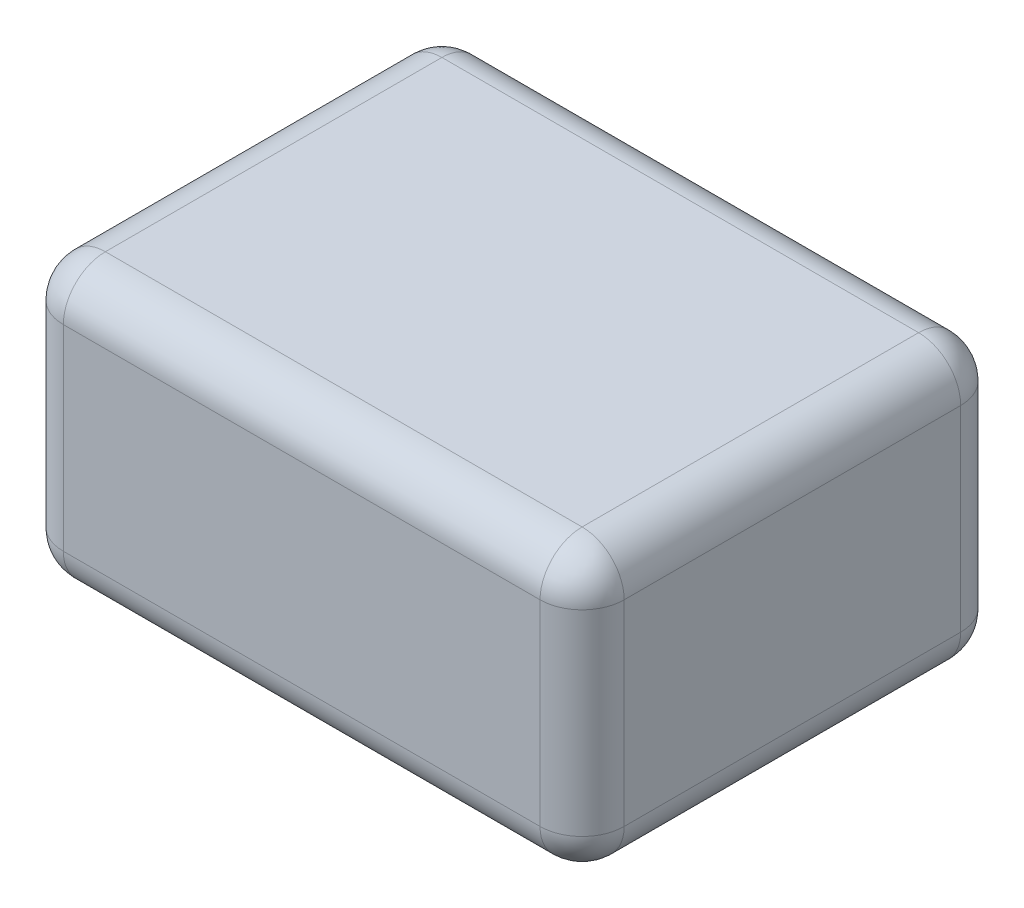
from build123d import *

# Parameters (mm, degrees)
SKETCH1_W           = 40
SKETCH1_H           = 30
BOSS_EXTRUDE1_DEPTH = 20
FILLET1_R           = 3


with BuildPart() as part:
    # Sketch1 → Boss-Extrude1 (new body)
    with BuildSketch(Plane(origin=(0, 0, 0), x_dir=(1, 0, 0), z_dir=(0, 1, 0))):
        Rectangle(SKETCH1_W, SKETCH1_H)
    extrude(amount=BOSS_EXTRUDE1_DEPTH)

    # Fillet1
    fillet1_edges = [part.edges().sort_by_distance(p)[0] for p in [
        (20, 20, 0),
        (0, 20, -15),
        (-20, 20, 0),
        (0, 0, -15),
        (20, 0, 0),
        (0, 0, 15),
        (-20, 0, 0),
        (-20, 10, -15),
        (20, 10, -15),
        (20, 10, 15),
        (-20, 10, 15),
        (0, 20, 15),
    ]]
    fillet(fillet1_edges, radius=FILLET1_R)


solid = part.part
